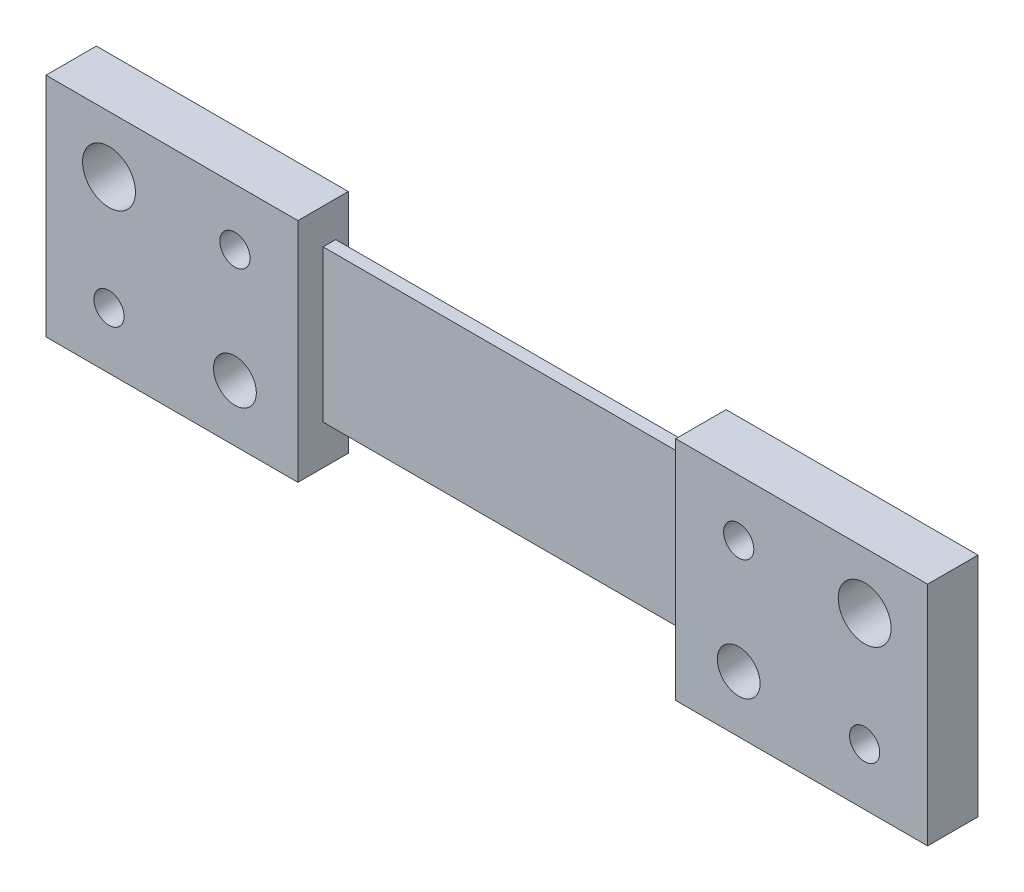
from build123d import *

# Parameters (mm, degrees)
SKETCH_1_W        = 20
SKETCH_1_H        = 18
SKETCH_1_R        = 1.2
SKETCH_1_R_2      = 1.7
SKETCH_1_R_3      = 2.1
EXTRUDE_1_DEPTH   = 4
EXTRUDE_1_2_DEPTH = 4
SKETCH_2_W        = 33.123219373
SKETCH_2_H        = 12.052469136
EXTRUDE_2_DEPTH   = 1


with BuildPart() as part:
    # Эскиз1 → Вытянуть1 (new body)
    with BuildSketch(Plane.XY):
        with Locations((25, 0)):
            Rectangle(SKETCH_1_W, SKETCH_1_H)
        with Locations(Location((30, -4.5, 0), (0, 0, 180))):
            Circle(SKETCH_1_R, mode=Mode.SUBTRACT)
        with Locations(Location((20, -4.5, 0), (0, 0, 180))):
            Circle(SKETCH_1_R_2, mode=Mode.SUBTRACT)
        with Locations(Location((20, 4.5, 0), (0, 0, 180))):
            Circle(SKETCH_1_R, mode=Mode.SUBTRACT)
        with Locations(Location((30, 4.5, 0), (0, 0, 180))):
            Circle(SKETCH_1_R_3, mode=Mode.SUBTRACT)
    extrude(amount=EXTRUDE_1_DEPTH)



with BuildPart() as body_2:
    # Эскиз1 → Extrude 1 2 (new body)
    with BuildSketch(Plane.XY):
        with Locations((-25, 0)):
            Rectangle(SKETCH_1_W, SKETCH_1_H)
        with Locations((-30, 4.5)):
            Circle(SKETCH_1_R_3, mode=Mode.SUBTRACT)
        with Locations((-20, 4.5)):
            Circle(SKETCH_1_R, mode=Mode.SUBTRACT)
        with Locations((-20, -4.5)):
            Circle(SKETCH_1_R_2, mode=Mode.SUBTRACT)
        with Locations((-30, -4.5)):
            Circle(SKETCH_1_R, mode=Mode.SUBTRACT)
    extrude(amount=EXTRUDE_1_2_DEPTH)


with BuildPart() as part_1:
    add(part.part)

    add(body_2.part)  # Вытянуть2 merges body 2
    # Эскиз2 → Вытянуть2 (add)
    with BuildSketch(Plane(origin=(0, 0, 2), x_dir=(-1, 0, 0), z_dir=(0, 0, -1))):
        with Locations((0.036443495, 0.168566002)):
            Rectangle(SKETCH_2_W, SKETCH_2_H)
    extrude(amount=EXTRUDE_2_DEPTH)


solid = part_1.part
